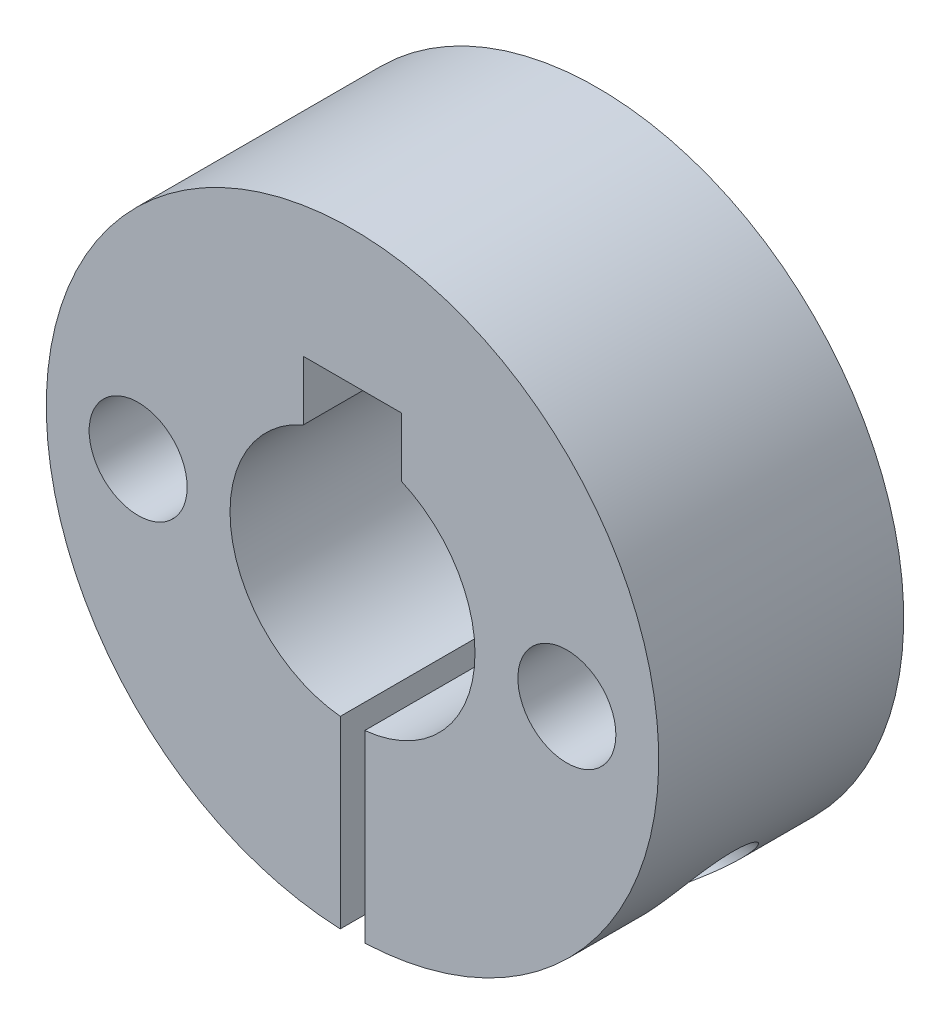
from build123d import *

# Parameters (mm, degrees)
SKETCH1_R               = 25
SKETCH1_R_2             = 10
BOSS_EXTRUDE1_DEPTH     = 10
CUT_EXTRUDE1_DEPTH      = 41.620192023
CUT_EXTRUDE1_DEPTH_BACK = 41.620192023
SKETCH2_R               = 4
SKETCH2_W               = 8
SKETCH2_H               = 8
SKETCH2_W_2             = 2
SKETCH2_H_2             = 20
CUT_EXTRUDE2_DEPTH      = 37.742346142
CUT_EXTRUDE2_DEPTH_BACK = 37.742346142
SKETCH3_R               = 4
CUT_EXTRUDE4_START      = -7
SKETCH5_R               = 6.75
CUT_EXTRUDE4_DEPTH      = 30.742346305


with BuildPart() as part:
    # Sketch1 → Boss-Extrude1 (new, symmetric)
    with BuildSketch(Plane.XY):
        Circle(SKETCH1_R)
        Circle(SKETCH1_R_2, mode=Mode.SUBTRACT)
    extrude(amount=BOSS_EXTRUDE1_DEPTH, both=True)

    # Sketch2 → Cut-Extrude1 (cut, two sides: drawn at the far end of the back side and taken through both)
    with BuildSketch(Plane.XY.offset(10).offset(-CUT_EXTRUDE1_DEPTH_BACK)):
        with Locations((17.5, 0)):
            Circle(SKETCH2_R)
        with Locations((-17.5, 0)):
            Circle(SKETCH2_R)
        with Locations((0, 10)):
            Rectangle(SKETCH2_W, SKETCH2_H)
        with Locations((0, -17.5)):
            Rectangle(SKETCH2_W_2, SKETCH2_H_2)
    extrude(amount=CUT_EXTRUDE1_DEPTH + CUT_EXTRUDE1_DEPTH_BACK, mode=Mode.SUBTRACT)

    # Sketch3 → Cut-Extrude2 (cut, two sides: drawn at the far end of the back side and taken through both)
    with BuildSketch(Plane(origin=(0, 0, 0), x_dir=(0, 0, -1), z_dir=(1, 0, 0)).offset(-CUT_EXTRUDE2_DEPTH_BACK)):
        with Locations((0, -17.464933182)):
            Circle(SKETCH3_R)
    extrude(amount=CUT_EXTRUDE2_DEPTH + CUT_EXTRUDE2_DEPTH_BACK, mode=Mode.SUBTRACT)

    # Sketch5 → Cut-Extrude4 (cut, through all)
    with BuildSketch(Plane(origin=(0, 0, 0), x_dir=(0, 0, -1), z_dir=(1, 0, 0)).offset(CUT_EXTRUDE4_START)):
        with Locations((0, -17.464933182)):
            Circle(SKETCH5_R)
    extrude(amount=-CUT_EXTRUDE4_DEPTH, mode=Mode.SUBTRACT)


solid = part.part
